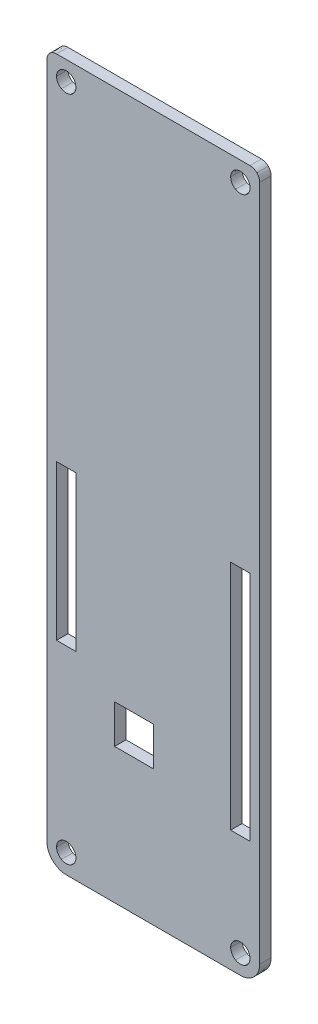
from build123d import *

# Parameters (mm, degrees)
MODEL_W            = 2.54
MODEL_H            = 30.48
MODEL_H_2          = 20.32
MODEL_W_2          = 5.08
MODEL_H_3          = 5.08
BOSS_EXTRU_1_DEPTH = 1.5


with BuildPart() as part:
    # Model → Boss.-Extru.1 (new body)
    with BuildSketch(Plane.XY):
        with BuildLine():
            Line((110.49, -34.813931), (110.49, -38.623931))
            Line((110.49, -38.623931), (110.49, -39.893931))
            Line((110.49, -39.893931), (110.49, -123.713931))
            add(Edge.make_bspline(
                [(109.746051, -125.509982), (110.222394, -125.03364), (110.49, -124.387581), (110.49, -123.713931)],
                knots=[0, 0, 0, 0, 1, 1, 1, 1], degree=3))
            add(Edge.make_bspline(
                [(107.95, -126.253931), (108.62365, -126.253931), (109.269709, -125.986325), (109.746051, -125.509982)],
                knots=[0, 0, 0, 0, 1, 1, 1, 1], degree=3))
            Line((107.95, -126.253931), (85.09, -126.253931))
            add(Edge.make_bspline(
                [(83.293949, -125.509982), (83.770291, -125.986325), (84.41635, -126.253931), (85.09, -126.253931)],
                knots=[0, 0, 0, 0, 1, 1, 1, 1], degree=3))
            add(Edge.make_bspline(
                [(82.55, -123.713931), (82.55, -124.387581), (82.817606, -125.03364), (83.293949, -125.509982)],
                knots=[0, 0, 0, 0, 1, 1, 1, 1], degree=3))
            Line((82.55, -123.713931), (82.55, -39.893931))
            Line((82.55, -39.893931), (82.55, -38.623931))
            Line((82.55, -38.623931), (82.55, -34.813931))
            add(Edge.make_bspline(
                [(82.921974, -33.915905), (82.683803, -34.154076), (82.55, -34.477106), (82.55, -34.813931)],
                knots=[0, 0, 0, 0, 1, 1, 1, 1], degree=3))
            add(Edge.make_bspline(
                [(83.82, -33.543931), (83.483175, -33.543931), (83.160146, -33.677734), (82.921974, -33.915905)],
                knots=[0, 0, 0, 0, 1, 1, 1, 1], degree=3))
            Line((83.82, -33.543931), (109.22, -33.543931))
            add(Edge.make_bspline(
                [(110.118026, -33.915905), (109.879854, -33.677734), (109.556825, -33.543931), (109.22, -33.543931)],
                knots=[0, 0, 0, 0, 1, 1, 1, 1], degree=3))
            add(Edge.make_bspline(
                [(110.49, -34.813931), (110.49, -34.477106), (110.356197, -34.154076), (110.118026, -33.915905)],
                knots=[0, 0, 0, 0, 1, 1, 1, 1], degree=3))
        make_face()
        with Locations((107.95, -95.138931)):
            Rectangle(MODEL_W, MODEL_H, mode=Mode.SUBTRACT)
        with Locations((85.09, -90.058931)):
            Rectangle(MODEL_W, MODEL_H_2, mode=Mode.SUBTRACT)
        with Locations((93.98, -105.933931)):
            Rectangle(MODEL_W_2, MODEL_H_3, mode=Mode.SUBTRACT)
        with BuildLine():
            add(Edge.make_bspline(
                [(109.22, -36.083931), (109.22, -36.537658), (108.977939, -36.956919), (108.585, -37.183783)],
                knots=[0, 0, 0, 0, 1, 1, 1, 1], degree=3))
            add(Edge.make_bspline(
                [(108.585, -37.183783), (108.192061, -37.410647), (107.707939, -37.410647), (107.315, -37.183783)],
                knots=[0, 0, 0, 0, 1, 1, 1, 1], degree=3))
            add(Edge.make_bspline(
                [(107.315, -37.183783), (106.922061, -36.956919), (106.68, -36.537658), (106.68, -36.083931)],
                knots=[0, 0, 0, 0, 1, 1, 1, 1], degree=3))
            add(Edge.make_bspline(
                [(106.68, -36.083931), (106.68, -35.630204), (106.922061, -35.210942), (107.315, -34.984079)],
                knots=[0, 0, 0, 0, 1, 1, 1, 1], degree=3))
            add(Edge.make_bspline(
                [(107.315, -34.984079), (107.707939, -34.757215), (108.192061, -34.757215), (108.585, -34.984079)],
                knots=[0, 0, 0, 0, 1, 1, 1, 1], degree=3))
            add(Edge.make_bspline(
                [(108.585, -34.984079), (108.977939, -35.210942), (109.22, -35.630204), (109.22, -36.083931)],
                knots=[0, 0, 0, 0, 1, 1, 1, 1], degree=3))
        make_face(mode=Mode.SUBTRACT)
        with BuildLine():
            add(Edge.make_bspline(
                [(86.36, -36.083931), (86.36, -36.537658), (86.117939, -36.956919), (85.725, -37.183783)],
                knots=[0, 0, 0, 0, 1, 1, 1, 1], degree=3))
            add(Edge.make_bspline(
                [(85.725, -37.183783), (85.332061, -37.410647), (84.847939, -37.410647), (84.455, -37.183783)],
                knots=[0, 0, 0, 0, 1, 1, 1, 1], degree=3))
            add(Edge.make_bspline(
                [(84.455, -37.183783), (84.062061, -36.956919), (83.82, -36.537658), (83.82, -36.083931)],
                knots=[0, 0, 0, 0, 1, 1, 1, 1], degree=3))
            add(Edge.make_bspline(
                [(83.82, -36.083931), (83.82, -35.630204), (84.062061, -35.210942), (84.455, -34.984079)],
                knots=[0, 0, 0, 0, 1, 1, 1, 1], degree=3))
            add(Edge.make_bspline(
                [(84.455, -34.984079), (84.847939, -34.757215), (85.332061, -34.757215), (85.725, -34.984079)],
                knots=[0, 0, 0, 0, 1, 1, 1, 1], degree=3))
            add(Edge.make_bspline(
                [(85.725, -34.984079), (86.117939, -35.210942), (86.36, -35.630204), (86.36, -36.083931)],
                knots=[0, 0, 0, 0, 1, 1, 1, 1], degree=3))
        make_face(mode=Mode.SUBTRACT)
        with BuildLine():
            add(Edge.make_bspline(
                [(86.36, -123.713931), (86.36, -124.167658), (86.117939, -124.586919), (85.725, -124.813783)],
                knots=[0, 0, 0, 0, 1, 1, 1, 1], degree=3))
            add(Edge.make_bspline(
                [(85.725, -124.813783), (85.332061, -125.040647), (84.847939, -125.040647), (84.455, -124.813783)],
                knots=[0, 0, 0, 0, 1, 1, 1, 1], degree=3))
            add(Edge.make_bspline(
                [(84.455, -124.813783), (84.062061, -124.586919), (83.82, -124.167658), (83.82, -123.713931)],
                knots=[0, 0, 0, 0, 1, 1, 1, 1], degree=3))
            add(Edge.make_bspline(
                [(83.82, -123.713931), (83.82, -123.260204), (84.062061, -122.840942), (84.455, -122.614079)],
                knots=[0, 0, 0, 0, 1, 1, 1, 1], degree=3))
            add(Edge.make_bspline(
                [(84.455, -122.614079), (84.847939, -122.387215), (85.332061, -122.387215), (85.725, -122.614079)],
                knots=[0, 0, 0, 0, 1, 1, 1, 1], degree=3))
            add(Edge.make_bspline(
                [(85.725, -122.614079), (86.117939, -122.840942), (86.36, -123.260204), (86.36, -123.713931)],
                knots=[0, 0, 0, 0, 1, 1, 1, 1], degree=3))
        make_face(mode=Mode.SUBTRACT)
        with BuildLine():
            add(Edge.make_bspline(
                [(109.22, -123.713931), (109.22, -124.167658), (108.977939, -124.586919), (108.585, -124.813783)],
                knots=[0, 0, 0, 0, 1, 1, 1, 1], degree=3))
            add(Edge.make_bspline(
                [(108.585, -124.813783), (108.192061, -125.040647), (107.707939, -125.040647), (107.315, -124.813783)],
                knots=[0, 0, 0, 0, 1, 1, 1, 1], degree=3))
            add(Edge.make_bspline(
                [(107.315, -124.813783), (106.922061, -124.586919), (106.68, -124.167658), (106.68, -123.713931)],
                knots=[0, 0, 0, 0, 1, 1, 1, 1], degree=3))
            add(Edge.make_bspline(
                [(106.68, -123.713931), (106.68, -123.260204), (106.922061, -122.840942), (107.315, -122.614079)],
                knots=[0, 0, 0, 0, 1, 1, 1, 1], degree=3))
            add(Edge.make_bspline(
                [(107.315, -122.614079), (107.707939, -122.387215), (108.192061, -122.387215), (108.585, -122.614079)],
                knots=[0, 0, 0, 0, 1, 1, 1, 1], degree=3))
            add(Edge.make_bspline(
                [(108.585, -122.614079), (108.977939, -122.840942), (109.22, -123.260204), (109.22, -123.713931)],
                knots=[0, 0, 0, 0, 1, 1, 1, 1], degree=3))
        make_face(mode=Mode.SUBTRACT)
    extrude(amount=BOSS_EXTRU_1_DEPTH)


solid = part.part
